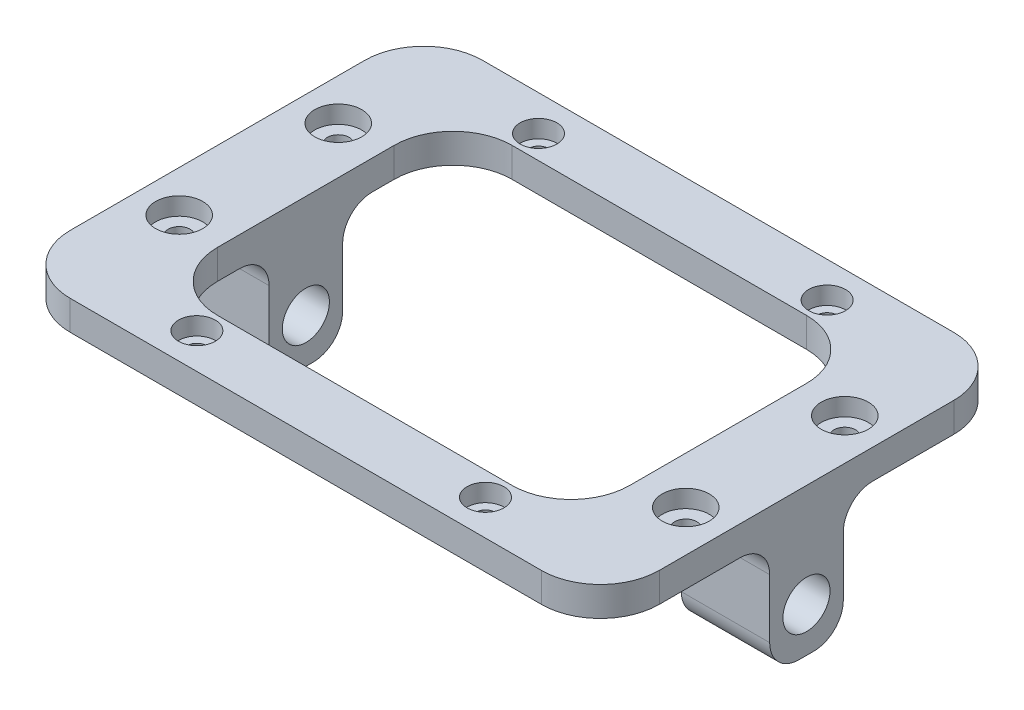
from build123d import *

# Parameters (mm, degrees)
SKETCH1_W                                  = 100
SKETCH1_H                                  = 70
BOSS_EXTRUDE1_DEPTH                        = 5
FILLET1_R                                  = 10
CUT_EXTRUDE1_REACH                         = 63.237
SKETCH2_R                                  = 1.85
MIRROR1_AT_THE_SECOND_PLANE_COPY_1_REACH   = 63.237
MIRROR1_AT_THE_SECOND_PLANE_COPY_1_SKETC_R = 1.85
CUT_EXTRUDE2_REACH                         = 63.237
SKETCH3_R                                  = 1.625
MIRROR2_AT_THE_SECOND_PLANE_COPY_1_REACH   = 63.237
MIRROR2_AT_THE_SECOND_PLANE_COPY_1_SKETC_R = 1.625
CUT_EXTRUDE3_REACH                         = 63.237
SKETCH4_W                                  = 70
SKETCH4_H                                  = 50
FILLET2_R                                  = 10
SKETCH5_R                                  = 3.125
CUT_EXTRUDE4_DEPTH                         = 3
MIRROR3_AT_THE_SECOND_PLANE_COPY_1_SKETC_R = 3.125
MIRROR3_AT_THE_SECOND_PLANE_COPY_1_DEPTH   = 3
SKETCH6_R                                  = 4
CUT_EXTRUDE5_DEPTH                         = 3
MIRROR4_AT_THE_SECOND_PLANE_COPY_1_SKETC_R = 4
MIRROR4_AT_THE_SECOND_PLANE_COPY_1_DEPTH   = 3
SKETCH9_W                                  = 15
SKETCH9_H                                  = 12.5
BOSS_EXTRUDE3_DEPTH                        = 20
CUT_EXTRUDE7_REACH                         = 109.819
SKETCH10_R                                 = 4
FILLET4_R                                  = 5


with BuildPart() as part:
    # Sketch1 → Boss-Extrude1 (new body)
    with BuildSketch(Plane(origin=(0, 0, 0), x_dir=(1, 0, 0), z_dir=(0, 1, 0))):
        Rectangle(SKETCH1_W, SKETCH1_H)
    extrude(amount=BOSS_EXTRUDE1_DEPTH)

    # Fillet1
    fillet1_edges = [part.edges().sort_by_distance(p)[0] for p in [
        (-50, 2.5, -35),
        (50, 2.5, -35),
        (50, 2.5, 35),
        (-50, 2.5, 35),
    ]]
    fillet(fillet1_edges, radius=FILLET1_R)

    # Sketch2 → Cut-Extrude1 (cut, up to next)
    with BuildSketch(Plane(origin=(0, 5, 0), x_dir=(1, 0, 0), z_dir=(0, 1, 0)), mode=Mode.PRIVATE) as cut_extrude1_sk1:
        with Locations(Location((-43, 13.5, 0), (0, 0, 270))):
            Circle(SKETCH2_R)
    cut_extrude1_tool1 = extrude(cut_extrude1_sk1.sketch, amount=-CUT_EXTRUDE1_REACH, mode=Mode.PRIVATE) & part.part
    cut_extrude1 = cut_extrude1_tool1.solids().sort_by_distance((-43, 5, -13.5))[0]
    add(cut_extrude1, mode=Mode.SUBTRACT)

    # Mirror1: Cut-Extrude1 across plane
    add(cut_extrude1.mirror(Plane(origin=(0, 0, 0), x_dir=(0, 0, 1), z_dir=(1, 0, 0))), mode=Mode.SUBTRACT)

    # Mirror1 at the second plane: Cut-Extrude1 across plane
    add(cut_extrude1.mirror(Plane.XY), mode=Mode.SUBTRACT)

    # Mirror1 at the second plane copy 1 sketc → Mirror1 at the second plane copy 1 (cut, up to next)
    with BuildSketch(Plane(origin=(0, 5, 0), x_dir=(-1, 0, 0), z_dir=(0, 1, 0)), mode=Mode.PRIVATE) as mirror1_at_the_second_plane_copy_1_sk1:
        with Locations(Location((-43, 13.5, 0), (0, 0, 270))):
            Circle(MIRROR1_AT_THE_SECOND_PLANE_COPY_1_SKETC_R)
    mirror1_at_the_second_plane_copy_1_tool1 = extrude(mirror1_at_the_second_plane_copy_1_sk1.sketch, amount=-MIRROR1_AT_THE_SECOND_PLANE_COPY_1_REACH, mode=Mode.PRIVATE) & part.part
    add(mirror1_at_the_second_plane_copy_1_tool1.solids().sort_by_distance((43, 5, 13.5))[0], mode=Mode.SUBTRACT)

    # Sketch3 → Cut-Extrude2 (cut, up to next)
    with BuildSketch(Plane(origin=(0, 5, 0), x_dir=(1, 0, 0), z_dir=(0, 1, 0)), mode=Mode.PRIVATE) as cut_extrude2_sk1:
        with Locations(Location((-24.5, 29, 0), (0, 0, 270))):
            Circle(SKETCH3_R)
    cut_extrude2_tool1 = extrude(cut_extrude2_sk1.sketch, amount=-CUT_EXTRUDE2_REACH, mode=Mode.PRIVATE) & part.part
    cut_extrude2 = cut_extrude2_tool1.solids().sort_by_distance((-24.5, 5, -29))[0]
    add(cut_extrude2, mode=Mode.SUBTRACT)

    # Mirror2: Cut-Extrude2 across plane
    add(cut_extrude2.mirror(Plane(origin=(0, 0, 0), x_dir=(0, 0, 1), z_dir=(1, 0, 0))), mode=Mode.SUBTRACT)

    # Mirror2 at the second plane: Cut-Extrude2 across plane
    add(cut_extrude2.mirror(Plane.XY), mode=Mode.SUBTRACT)

    # Mirror2 at the second plane copy 1 sketc → Mirror2 at the second plane copy 1 (cut, up to next)
    with BuildSketch(Plane(origin=(0, 5, 0), x_dir=(-1, 0, 0), z_dir=(0, 1, 0)), mode=Mode.PRIVATE) as mirror2_at_the_second_plane_copy_1_sk1:
        with Locations(Location((-24.5, 29, 0), (0, 0, 270))):
            Circle(MIRROR2_AT_THE_SECOND_PLANE_COPY_1_SKETC_R)
    mirror2_at_the_second_plane_copy_1_tool1 = extrude(mirror2_at_the_second_plane_copy_1_sk1.sketch, amount=-MIRROR2_AT_THE_SECOND_PLANE_COPY_1_REACH, mode=Mode.PRIVATE) & part.part
    add(mirror2_at_the_second_plane_copy_1_tool1.solids().sort_by_distance((24.5, 5, 29))[0], mode=Mode.SUBTRACT)

    # Sketch4 → Cut-Extrude3 (cut, up to next)
    with BuildSketch(Plane(origin=(0, 5, 0), x_dir=(1, 0, 0), z_dir=(0, 1, 0)), mode=Mode.PRIVATE) as cut_extrude3_sk1:
        Rectangle(SKETCH4_W, SKETCH4_H)
    cut_extrude3_tool1 = extrude(cut_extrude3_sk1.sketch, amount=-CUT_EXTRUDE3_REACH, mode=Mode.PRIVATE) & part.part
    add(cut_extrude3_tool1.solids().sort_by_distance((0, 5, 0))[0], mode=Mode.SUBTRACT)

    # Fillet2
    fillet2_edges = [part.edges().sort_by_distance(p)[0] for p in [
        (-35, 2.5, 25),
        (-35, 2.5, -25),
        (35, 2.5, -25),
        (35, 2.5, 25),
    ]]
    fillet(fillet2_edges, radius=FILLET2_R)

    # Sketch5 → Cut-Extrude4 (cut)
    with BuildSketch(Plane(origin=(0, 5, 0), x_dir=(1, 0, 0), z_dir=(0, 1, 0))):
        with Locations(Location((-24.5, 29, 0), (0, 0, 270))):
            Circle(SKETCH5_R)
    cut_extrude4 = extrude(amount=-CUT_EXTRUDE4_DEPTH, mode=Mode.SUBTRACT)

    # Mirror3: Cut-Extrude4 across plane
    add(cut_extrude4.mirror(Plane.XY), mode=Mode.SUBTRACT)

    # Mirror3 at the second plane: Cut-Extrude4 across plane
    add(cut_extrude4.mirror(Plane(origin=(0, 0, 0), x_dir=(0, 0, 1), z_dir=(1, 0, 0))), mode=Mode.SUBTRACT)

    # Mirror3 at the second plane copy 1 sketc → Mirror3 at the second plane copy 1 (cut)
    with BuildSketch(Plane(origin=(0, 5, 0), x_dir=(-1, 0, 0), z_dir=(0, 1, 0))):
        with Locations(Location((-24.5, 29, 0), (0, 0, 270))):
            Circle(MIRROR3_AT_THE_SECOND_PLANE_COPY_1_SKETC_R)
    extrude(amount=-MIRROR3_AT_THE_SECOND_PLANE_COPY_1_DEPTH, mode=Mode.SUBTRACT)

    # Sketch6 → Cut-Extrude5 (cut)
    with BuildSketch(Plane(origin=(0, 5, 0), x_dir=(1, 0, 0), z_dir=(0, 1, 0))):
        with Locations(Location((-43, 13.5, 0), (0, 0, 270))):
            Circle(SKETCH6_R)
    cut_extrude5 = extrude(amount=-CUT_EXTRUDE5_DEPTH, mode=Mode.SUBTRACT)

    # Mirror4: Cut-Extrude5 across plane
    add(cut_extrude5.mirror(Plane(origin=(0, 0, 0), x_dir=(0, 0, 1), z_dir=(1, 0, 0))), mode=Mode.SUBTRACT)

    # Mirror4 at the second plane: Cut-Extrude5 across plane
    add(cut_extrude5.mirror(Plane.XY), mode=Mode.SUBTRACT)

    # Mirror4 at the second plane copy 1 sketc → Mirror4 at the second plane copy 1 (cut)
    with BuildSketch(Plane(origin=(0, 5, 0), x_dir=(-1, 0, 0), z_dir=(0, 1, 0))):
        with Locations(Location((-43, 13.5, 0), (0, 0, 270))):
            Circle(MIRROR4_AT_THE_SECOND_PLANE_COPY_1_SKETC_R)
    extrude(amount=-MIRROR4_AT_THE_SECOND_PLANE_COPY_1_DEPTH, mode=Mode.SUBTRACT)

    # Sketch9 → Boss-Extrude3 (add)
    with BuildSketch(Plane.XZ):
        with Locations((-42.5, 0)):
            Rectangle(SKETCH9_W, SKETCH9_H)
        with Locations((42.5, 0)):
            Rectangle(SKETCH9_W, SKETCH9_H)
    extrude(amount=BOSS_EXTRUDE3_DEPTH)

    # Cut-Extrude7: up to this face of the body (flat: up to its plane)
    cut_extrude7_end = Plane(part.part.faces().sort_by_distance((50, -3.75, 0))[0])
    # Sketch10 → Cut-Extrude7 (cut, up to the picked face)
    with BuildSketch(Plane.ZY.offset(50), mode=Mode.PRIVATE) as cut_extrude7_sk1:
        with Locations((0, -12.5)):
            Circle(SKETCH10_R)
    cut_extrude7_tool1 = split(extrude(cut_extrude7_sk1.sketch, amount=-CUT_EXTRUDE7_REACH, mode=Mode.PRIVATE), bisect_by=cut_extrude7_end, keep=Keep.BOTH, mode=Mode.PRIVATE)
    add(cut_extrude7_tool1.solids().sort_by(Axis((-50, -12.5, 0), (1, 0, 0)))[0], mode=Mode.SUBTRACT)

    # Fillet4
    fillet4_edges = [part.edges().sort_by_distance(p)[0] for p in [
        (-42.5, 0, -6.25),
        (-42.5, 0, 6.25),
        (-42.5, -20, -6.25),
        (-42.5, -20, 6.25),
        (42.5, 0, -6.25),
        (42.5, 0, 6.25),
        (42.5, -20, -6.25),
        (42.5, -20, 6.25),
    ]]
    fillet(fillet4_edges, radius=FILLET4_R)


solid = part.part
